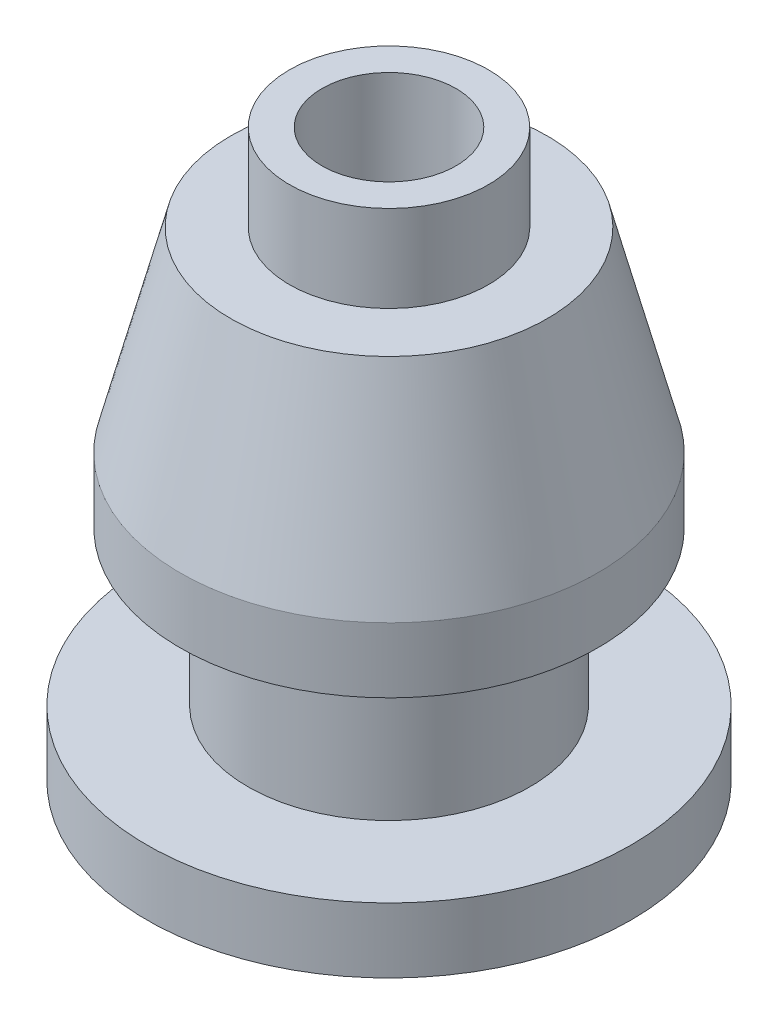
from build123d import *


with BuildPart() as part:
    # Sketch1 → Revolve1 (revolve)
    with BuildSketch(Plane.XY, mode=Mode.PRIVATE) as revolve1_sk:
        Polygon((30.957446809, 237.530722145), (30.957446809, -23.639490621), (111.70212766, -23.639490621), (111.70212766, 6.360509379), (65.106382979, 6.360509379), (65.106382979, 77.530722145), (96.382978723, 77.530722145), (96.382978723, 107.530722145), (73.085106383, 197.530722145), (45.957446809, 197.530722145), (45.957446809, 237.530722145), align=None)
    revolve(revolve1_sk.sketch.rotate(Axis((0, 2.553191489, 0), (0, -1, 0)), 180), axis=Axis((0, 2.553191489, 0), (0, -1, 0)))


solid = part.part
